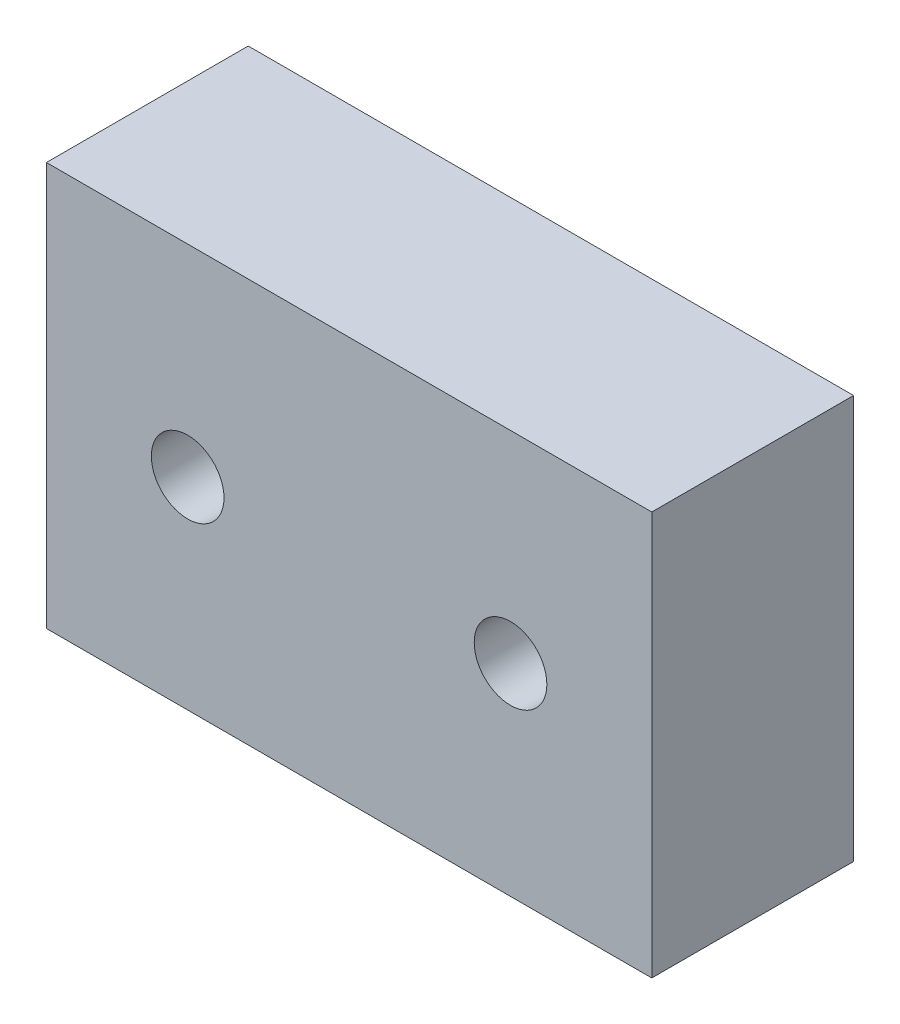
from build123d import *

# Parameters (mm, degrees)
BOSS_EXTRU_1_DEPTH      = 3
BOSS_EXTRU_1_DEPTH_BACK = 2
ESQUISSE1_W             = 15
ESQUISSE1_H             = 10
D_GAGEMENT_M1_61_D      = 1.8
D_GAGEMENT_M1_61_DEPTH  = 28.17
D_GAGEMENT_M1_61_TIP    = 0.540774557
D_GAGEMENT_M1_62_D      = 3
D_GAGEMENT_M1_62_DEPTH  = 3
D_GAGEMENT_M1_62_TIP    = 0.901290929


with BuildPart() as part:
    # Esquisse1 → Boss.-Extru.1 (new, two sides: drawn at the far end of the back side and taken through both)
    with BuildSketch(Plane.XY.offset(-BOSS_EXTRU_1_DEPTH_BACK)):
        with Locations((-17.922006263, -28.608262445)):
            Rectangle(ESQUISSE1_W, ESQUISSE1_H)
    extrude(amount=BOSS_EXTRU_1_DEPTH + BOSS_EXTRU_1_DEPTH_BACK)

    # Dégagement M1.61
    with Locations(Plane(origin=(-21.922006263, -28.608262445, -2), x_dir=(-1, 0, 0), z_dir=(0, 0, -1))):
        with Locations((0, 0), (-8, 0)):
            Hole(D_GAGEMENT_M1_61_D / 2, depth=D_GAGEMENT_M1_61_DEPTH)
            with Locations((0, 0, -(D_GAGEMENT_M1_61_DEPTH + D_GAGEMENT_M1_61_TIP / 2))):  # 118° drill point
                Cone(0, D_GAGEMENT_M1_61_D / 2, D_GAGEMENT_M1_61_TIP, mode=Mode.SUBTRACT)

    # Dégagement M1.62
    with Locations(Plane(origin=(-17.922006263, -33.608262445, 0.5), x_dir=(0, 0, -1), z_dir=(0, -1, 0))):
        with Locations((0, 0)):
            Hole(D_GAGEMENT_M1_62_D / 2, depth=D_GAGEMENT_M1_62_DEPTH)
            with Locations((0, 0, -(D_GAGEMENT_M1_62_DEPTH + D_GAGEMENT_M1_62_TIP / 2))):  # 118° drill point
                Cone(0, D_GAGEMENT_M1_62_D / 2, D_GAGEMENT_M1_62_TIP, mode=Mode.SUBTRACT)


solid = part.part
